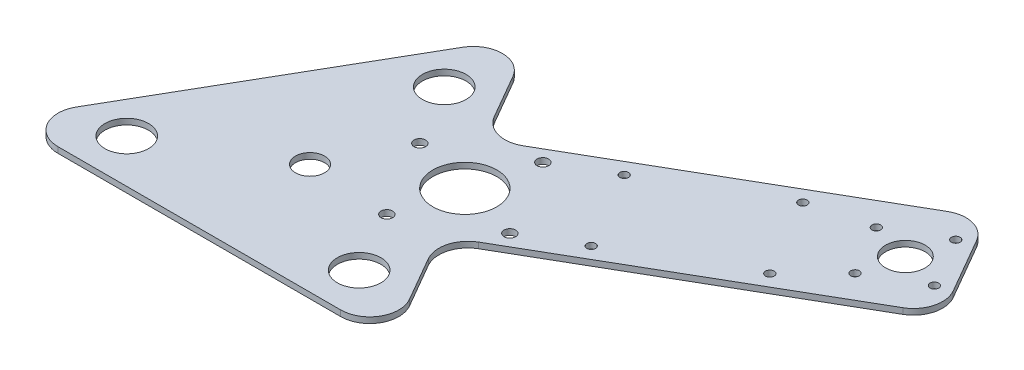
from build123d import *

# Parameters (mm, degrees)
SKETCH1_R           = 7.5
SKETCH1_R_2         = 5
BOSS_EXTRUDE1_DEPTH = 2
BOSS_EXTRUDE2_DEPTH = 2
FILLET1_R           = 10
SKETCH4_R           = 11
SKETCH4_R_2         = 2
CUT_EXTRUDE1_DEPTH  = 2
SKETCH6_R           = 6.8
CUT_EXTRUDE2_DEPTH  = 10
SKETCH8_R           = 1.5
CUT_EXTRUDE3_DEPTH  = 179.433043373
SKETCH9_R           = 1.5
CUT_EXTRUDE4_DEPTH  = 10


with BuildPart() as part:
    # Sketch1 → Boss-Extrude1 (new body)
    with BuildSketch(Plane(origin=(0, 0, 0), x_dir=(1, 0, 0), z_dir=(0, 1, 0))):
        Polygon((0, 76.188021535), (-65.980762114, -38.094010768), (65.980762114, -38.094010768), align=None)
        with Locations(Location((0, 46.188021535, 0), (0, 0, 270))):
            Circle(SKETCH1_R, mode=Mode.SUBTRACT)
        with Locations(Location((-40, -23.094010768, 0), (0, 0, 270))):
            Circle(SKETCH1_R, mode=Mode.SUBTRACT)
        with Locations(Location((40, -23.094010768, 0), (0, 0, 270))):
            Circle(SKETCH1_R, mode=Mode.SUBTRACT)
        with Locations(Location((0, 0, 0), (0, 0, 270))):
            Circle(SKETCH1_R_2, mode=Mode.SUBTRACT)
    extrude(amount=BOSS_EXTRUDE1_DEPTH)

    # Sketch2 → Boss-Extrude2 (add)
    with BuildSketch(Plane(origin=(0, 2, 0), x_dir=(1, 0, 0), z_dir=(0, 1, 0))):
        Polygon((43.490381057, 0.860471904), (22.490381057, 37.233538863), (132.394191624, 100.686533479), (153.394191624, 64.313466521), align=None)
    extrude(amount=-BOSS_EXTRUDE2_DEPTH)

    # Fillet1
    fillet1_edges = [part.edges().sort_by_distance(p)[0] for p in [
        (153.394191624, 1, -64.313466521),
        (43.490381057, 1, -0.860471904),
        (22.490381057, 1, -37.233538863),
        (132.394191624, 1, -100.686533479),
        (65.980762114, 1, 38.094010768),
        (-65.980762114, 1, 38.094010768),
        (0, 1, -76.188021535),
    ]]
    fillet(fillet1_edges, radius=FILLET1_R)

    # Sketch4 → Cut-Extrude1 (cut)
    with BuildSketch(Plane(origin=(0, 2, 0), x_dir=(1, 0, 0), z_dir=(0, 1, 0))):
        with Locations(Location((33.774990748, 19.5, 0), (0, 0, 270))):
            Circle(SKETCH4_R)
        with Locations(Location((39.448384506, 40.673393759, 0), (0, 0, 270))):
            Circle(SKETCH4_R_2)
        with Locations(Location((54.948384506, 13.826606241, 0), (0, 0, 270))):
            Circle(SKETCH4_R_2)
        with Locations(Location((28.101596989, -1.673393759, 0), (0, 0, 270))):
            Circle(SKETCH4_R_2)
        with Locations(Location((12.601596989, 25.173393759, 0), (0, 0, 270))):
            Circle(SKETCH4_R_2)
    extrude(amount=-CUT_EXTRUDE1_DEPTH, mode=Mode.SUBTRACT)

    # Sketch6 → Cut-Extrude2 (cut)
    with BuildSketch(Plane(origin=(0, 2, 0), x_dir=(1, 0, 0), z_dir=(0, 1, 0))):
        with Locations(Location((129.903810568, 75, 0), (0, 0, 270))):
            Circle(SKETCH6_R)
    extrude(amount=-CUT_EXTRUDE2_DEPTH, mode=Mode.SUBTRACT)

    # Sketch8 → Cut-Extrude3 (cut, through all)
    with BuildSketch(Plane(origin=(0, 2, 0), x_dir=(1, 0, 0), z_dir=(0, 1, 0))):
        with Locations(Location((133.564064606, 88.660254038, 0), (0, 0, 270))):
            Circle(SKETCH8_R)
        with Locations(Location((143.564064606, 71.339745962, 0), (0, 0, 270))):
            Circle(SKETCH8_R)
        with Locations(Location((126.24355653, 61.339745962, 0), (0, 0, 270))):
            Circle(SKETCH8_R)
        with Locations(Location((116.24355653, 78.660254038, 0), (0, 0, 270))):
            Circle(SKETCH8_R)
    extrude(amount=-CUT_EXTRUDE3_DEPTH, mode=Mode.SUBTRACT)

    # Sketch9 → Cut-Extrude4 (cut)
    with BuildSketch(Plane(origin=(0, 2, 0), x_dir=(1, 0, 0), z_dir=(0, 1, 0))):
        with Locations(Location((57.201905284, 50.923393759, 0), (0, 0, 270))):
            Circle(SKETCH9_R)
        with Locations(Location((72.701905284, 24.076606241, 0), (0, 0, 270))):
            Circle(SKETCH9_R)
        with Locations(Location((111.673048454, 46.576606241, 0), (0, 0, 270))):
            Circle(SKETCH9_R)
        with Locations(Location((96.173048454, 73.423393759, 0), (0, 0, 270))):
            Circle(SKETCH9_R)
    extrude(amount=-CUT_EXTRUDE4_DEPTH, mode=Mode.SUBTRACT)


solid = part.part
